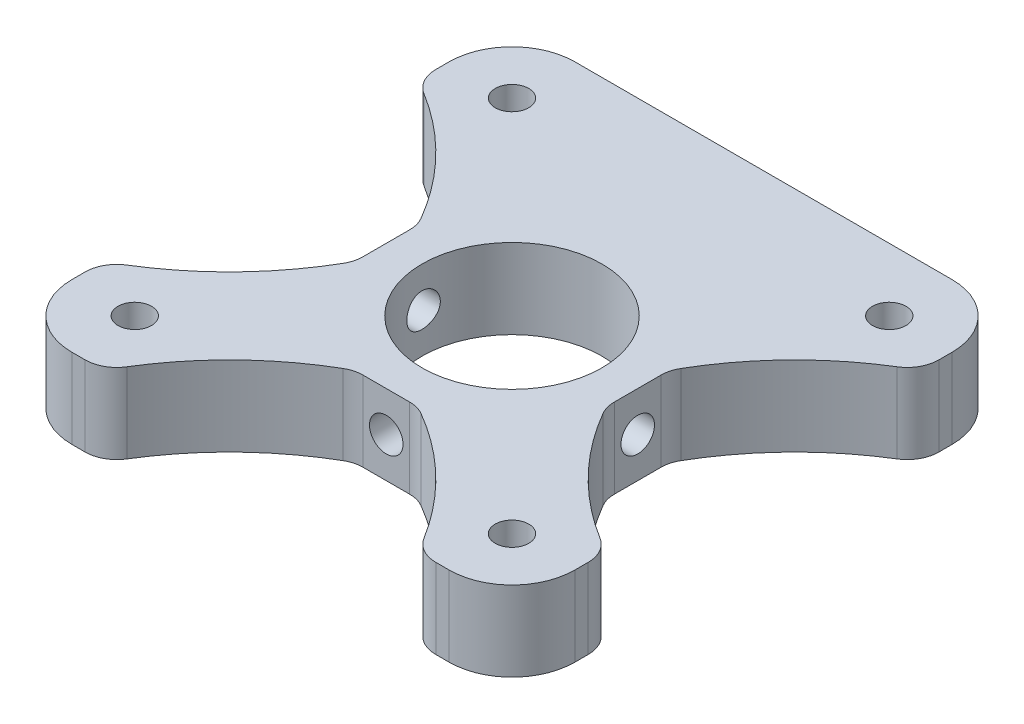
from build123d import *

# Parameters (mm, degrees)
SKETCH1_W                 = 80
SKETCH1_H                 = 80
SKETCH1_R                 = 14.3129
BOSS_EXTRUDE1_DEPTH       = 12.7
FILLET1_R                 = 10
CUT_EXTRUDE1_REACH        = 59.977
CUT_EXTRUDE2_REACH        = 75.221
CUT_EXTRUDE2_END_RADIUS   = 14.3129
SKETCH3_R                 = 2.665
FILLET2_R                 = 5
CUT_EXTRUDE3_REACH        = 59.977
SKETCH4_R                 = 2.665
CIRPATTERN1_COUNT         = 3
CIRPATTERN1_ANGLE         = 180
FILLET3_R                 = 5
CIRPATTERN2_COUNT         = 3
CIRPATTERN2_ANGLE         = 180
M5X0_8_TAPPED_HOLE1_D     = 4.2
M5X0_8_TAPPED_HOLE1_DEPTH = 6.35
M5X0_8_TAPPED_HOLE1_TIP   = 1.2618073


with BuildPart() as part:
    # Sketch1 → Boss-Extrude1 (new body)
    with BuildSketch(Plane(origin=(0, 0, 0), x_dir=(1, 0, 0), z_dir=(0, 1, 0))):
        Rectangle(SKETCH1_W, SKETCH1_H)
        with Locations(Location((0, 0, 0), (0, 0, 270))):
            Circle(SKETCH1_R, mode=Mode.SUBTRACT)
    extrude(amount=BOSS_EXTRUDE1_DEPTH)

    # Fillet1
    fillet1_edges = [part.edges().sort_by_distance(p)[0] for p in [
        (40, 6.35, 40),
        (-40, 6.35, 40),
        (-40, 6.35, -40),
        (40, 6.35, -40),
    ]]
    fillet(fillet1_edges, radius=FILLET1_R)

    # Sketch2 → Cut-Extrude1 (cut, up to next)
    with BuildSketch(Plane(origin=(0, 12.7, 0), x_dir=(1, 0, 0), z_dir=(0, 1, 0)), mode=Mode.PRIVATE) as cut_extrude1_sk1:
        with BuildLine():
            ThreePointArc((40, 25), (28.556310856, 16.443689144), (20, 5))
            Line((20, 5), (20, 0))
            Line((20, 0), (40, 0))
            Line((40, 0), (40, 25))
        make_face()
    cut_extrude1_tool1 = extrude(cut_extrude1_sk1.sketch, amount=-CUT_EXTRUDE1_REACH, mode=Mode.PRIVATE) & part.part
    # Sketch2 → Cut-Extrude1 (cut, up to next)
    with BuildSketch(Plane(origin=(0, 12.7, 0), x_dir=(1, 0, 0), z_dir=(0, 1, 0)), mode=Mode.PRIVATE) as cut_extrude1_sk2:
        with BuildLine():
            Line((40, 0), (20, 0))
            Line((20, 0), (20, -5))
            ThreePointArc((20, -5), (28.556310856, -16.443689144), (40, -25))
            Line((40, -25), (40, 0))
        make_face()
    cut_extrude1_tool2 = extrude(cut_extrude1_sk2.sketch, amount=-CUT_EXTRUDE1_REACH, mode=Mode.PRIVATE) & part.part
    cut_extrude1_1 = cut_extrude1_tool1.solids().sort_by_distance((31.902516, 12.7, -9.406449))[0]
    add(cut_extrude1_1, mode=Mode.SUBTRACT)
    cut_extrude1_2 = cut_extrude1_tool2.solids().sort_by_distance((31.902516, 12.7, 9.406449))[0]
    add(cut_extrude1_2, mode=Mode.SUBTRACT)
    cut_extrude1 = cut_extrude1_1 + cut_extrude1_2  # Cut-Extrude1 as one shape, for the pattern or mirror that repeats it

    # Mirror1: Cut-Extrude1 across plane
    add(cut_extrude1.mirror(Plane(origin=(0, 0, 0), x_dir=(0, 0, 1), z_dir=(1, 0, 0))), mode=Mode.SUBTRACT)

    # Cut-Extrude2: up to this cylinder (the profile starts outside it)
    cut_extrude2_end = Plane(origin=(0, 6.35, 0), z_dir=(0, -1, 0)) * Cylinder(CUT_EXTRUDE2_END_RADIUS, 180.0678, mode=Mode.PRIVATE)
    # Sketch3 → Cut-Extrude2 (cut, up to the surface)
    with BuildSketch(Plane(origin=(20, 0, 0), x_dir=(0, 0, -1), z_dir=(1, 0, 0)), mode=Mode.PRIVATE) as cut_extrude2_sk1:
        with Locations((0, 6.35)):
            Circle(SKETCH3_R)
    cut_extrude2_tool1 = extrude(cut_extrude2_sk1.sketch, amount=-CUT_EXTRUDE2_REACH, mode=Mode.PRIVATE) - cut_extrude2_end
    cut_extrude2 = cut_extrude2_tool1.solids().sort_by_distance((20, 6.35, 0))[0]
    add(cut_extrude2, mode=Mode.SUBTRACT)

    # Fillet2
    fillet2_edges = [part.edges().sort_by_distance(p)[0] for p in [
        (20, 6.35, 5),
        (20, 6.35, -5),
        (40, 6.35, -25),
        (40, 6.35, 25),
        (-20, 6.35, -5),
        (-20, 6.35, 5),
        (-40, 6.35, 25),
        (-40, 6.35, -25),
    ]]
    fillet(fillet2_edges, radius=FILLET2_R)

    # Sketch4 → Cut-Extrude3 (cut, up to next)
    with BuildSketch(Plane(origin=(0, 12.7, 0), x_dir=(1, 0, 0), z_dir=(0, 1, 0)), mode=Mode.PRIVATE) as cut_extrude3_sk1:
        with Locations(Location((-30, 30, 0), (0, 0, 270))):
            Circle(SKETCH4_R)
    cut_extrude3_tool1 = extrude(cut_extrude3_sk1.sketch, amount=-CUT_EXTRUDE3_REACH, mode=Mode.PRIVATE) & part.part
    # Sketch4 → Cut-Extrude3 (cut, up to next)
    with BuildSketch(Plane(origin=(0, 12.7, 0), x_dir=(1, 0, 0), z_dir=(0, 1, 0)), mode=Mode.PRIVATE) as cut_extrude3_sk2:
        with Locations(Location((30, 30, 0), (0, 0, 270))):
            Circle(SKETCH4_R)
    cut_extrude3_tool2 = extrude(cut_extrude3_sk2.sketch, amount=-CUT_EXTRUDE3_REACH, mode=Mode.PRIVATE) & part.part
    # Sketch4 → Cut-Extrude3 (cut, up to next)
    with BuildSketch(Plane(origin=(0, 12.7, 0), x_dir=(1, 0, 0), z_dir=(0, 1, 0)), mode=Mode.PRIVATE) as cut_extrude3_sk3:
        with Locations(Location((30, -30, 0), (0, 0, 270))):
            Circle(SKETCH4_R)
    cut_extrude3_tool3 = extrude(cut_extrude3_sk3.sketch, amount=-CUT_EXTRUDE3_REACH, mode=Mode.PRIVATE) & part.part
    # Sketch4 → Cut-Extrude3 (cut, up to next)
    with BuildSketch(Plane(origin=(0, 12.7, 0), x_dir=(1, 0, 0), z_dir=(0, 1, 0)), mode=Mode.PRIVATE) as cut_extrude3_sk4:
        with Locations(Location((-30, -30, 0), (0, 0, 270))):
            Circle(SKETCH4_R)
    cut_extrude3_tool4 = extrude(cut_extrude3_sk4.sketch, amount=-CUT_EXTRUDE3_REACH, mode=Mode.PRIVATE) & part.part
    add(cut_extrude3_tool1.solids().sort_by_distance((-30, 12.7, -30))[0], mode=Mode.SUBTRACT)
    add(cut_extrude3_tool2.solids().sort_by_distance((30, 12.7, -30))[0], mode=Mode.SUBTRACT)
    add(cut_extrude3_tool3.solids().sort_by_distance((30, 12.7, 30))[0], mode=Mode.SUBTRACT)
    add(cut_extrude3_tool4.solids().sort_by_distance((-30, 12.7, 30))[0], mode=Mode.SUBTRACT)

    # CirPattern1: Cut-Extrude1 ×3 about axis
    cirpattern1_axis = Axis((0, 0, 0), (0, -1, 0))
    for i in range(1, CIRPATTERN1_COUNT):
        add(cut_extrude1.rotate(cirpattern1_axis, i * CIRPATTERN1_ANGLE / (CIRPATTERN1_COUNT - 1)), mode=Mode.SUBTRACT)

    # Fillet3
    fillet3_edges = [part.edges().sort_by_distance(p)[0] for p in [
        (-5, 6.35, 20),
        (5, 6.35, 20),
        (25, 6.35, 40),
        (-25, 6.35, 40),
        (-20, 6.35, 5),
        (-20, 6.35, -5),
    ]]
    fillet(fillet3_edges, radius=FILLET3_R)

    # CirPattern2: Cut-Extrude2 ×3 about axis
    cirpattern2_axis = Axis((0, 12.7, 0), (0, -1, 0))
    for i in range(1, CIRPATTERN2_COUNT):
        add(cut_extrude2.rotate(cirpattern2_axis, i * CIRPATTERN2_ANGLE / (CIRPATTERN2_COUNT - 1)), mode=Mode.SUBTRACT)

    # M5x0.8 Tapped Hole1
    with Locations(Plane(origin=(16.75, 6.35, -40), x_dir=(-1, 0, 0), z_dir=(0, 0, -1))):
        with Locations((0, 0), (33.5, 0)):
            Hole(M5X0_8_TAPPED_HOLE1_D / 2, depth=M5X0_8_TAPPED_HOLE1_DEPTH)
            with Locations((0, 0, -(M5X0_8_TAPPED_HOLE1_DEPTH + M5X0_8_TAPPED_HOLE1_TIP / 2))):  # 118° drill point
                Cone(0, M5X0_8_TAPPED_HOLE1_D / 2, M5X0_8_TAPPED_HOLE1_TIP, mode=Mode.SUBTRACT)


solid = part.part
